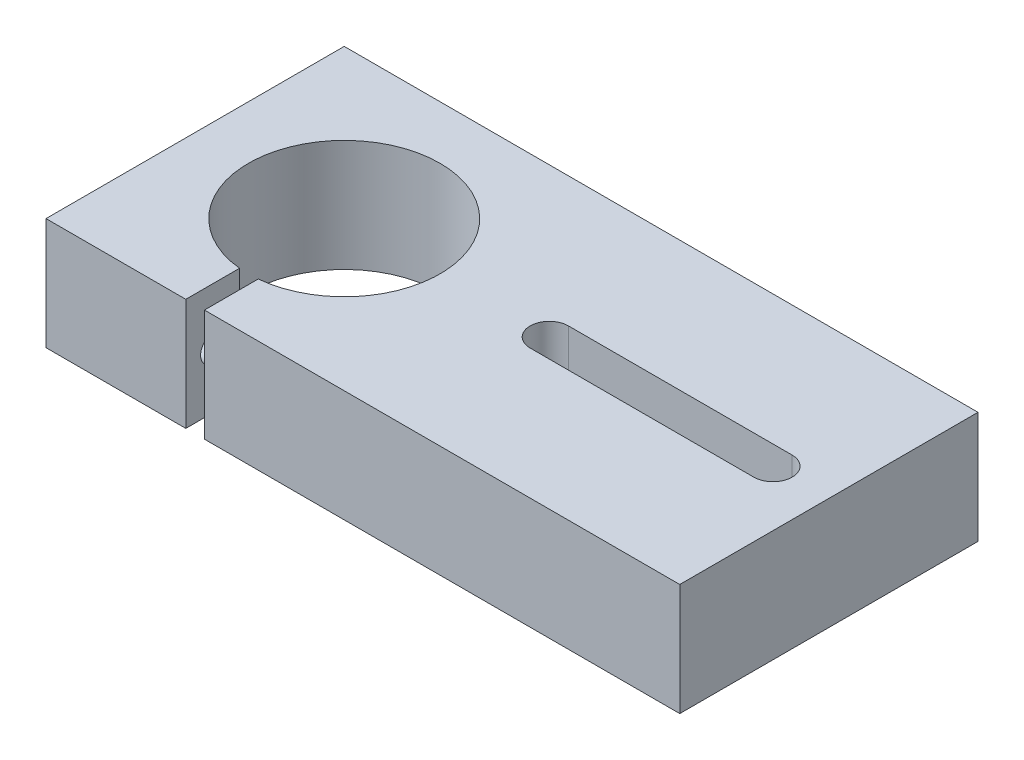
from build123d import *

# Parameters (mm, degrees)
SKETCH1_W                                      = 107.95
SKETCH1_H                                      = 50.8
BOSS_EXTRUDE1_DEPTH                            = 9.525
SKETCH2_R                                      = 16.3195
CUT_EXTRUDE1_DEPTH                             = 19.05
SKETCH3_W                                      = 3.175
SKETCH3_H                                      = 25.4
CUT_EXTRUDE2_DEPTH                             = 19.05
CBORE_FOR_8_SOCKET_HEAD_CAP_SCREW1_D           = 4.4958
CBORE_FOR_8_SOCKET_HEAD_CAP_SCREW1_DEPTH       = 23.8125
CBORE_FOR_8_SOCKET_HEAD_CAP_SCREW1_CBORE_D     = 7.9375
CBORE_FOR_8_SOCKET_HEAD_CAP_SCREW1_CBORE_DEPTH = 4.1656
F_8_32_TAPPED_HOLE1_D                          = 3.4544
F_8_32_TAPPED_HOLE1_DEPTH                      = 25.4
F_8_32_TAPPED_HOLE1_TIP                        = 1.037806461
CUT_EXTRUDE3_DEPTH                             = 19.05


with BuildPart() as part:
    # Sketch1 → Boss-Extrude1 (new, symmetric)
    with BuildSketch(Plane(origin=(0, 0, 0), x_dir=(1, 0, 0), z_dir=(0, 1, 0))):
        Rectangle(SKETCH1_W, SKETCH1_H)
    extrude(amount=BOSS_EXTRUDE1_DEPTH, both=True)

    # Sketch2 → Cut-Extrude1 (cut)
    with BuildSketch(Plane(origin=(0, 9.525, 0), x_dir=(1, 0, 0), z_dir=(0, 1, 0))):
        with Locations(Location((-28.575, 0, 0), (0, 0, 270))):
            Circle(SKETCH2_R)
    extrude(amount=-CUT_EXTRUDE1_DEPTH, mode=Mode.SUBTRACT)

    # Sketch3 → Cut-Extrude2 (cut)
    with BuildSketch(Plane(origin=(0, 9.525, 0), x_dir=(1, 0, 0), z_dir=(0, 1, 0))):
        with Locations((-28.575, -12.7)):
            Rectangle(SKETCH3_W, SKETCH3_H)
    extrude(amount=-CUT_EXTRUDE2_DEPTH, mode=Mode.SUBTRACT)

    # CBORE for #8 Socket Head Cap Screw1
    with Locations(Plane.ZY.offset(53.975)):
        with Locations((20.6375, 0)):
            CounterBoreHole(CBORE_FOR_8_SOCKET_HEAD_CAP_SCREW1_D / 2, CBORE_FOR_8_SOCKET_HEAD_CAP_SCREW1_CBORE_D / 2, CBORE_FOR_8_SOCKET_HEAD_CAP_SCREW1_CBORE_DEPTH, depth=CBORE_FOR_8_SOCKET_HEAD_CAP_SCREW1_DEPTH)

    # #8-32 Tapped Hole1
    with Locations(Plane.ZY.offset(26.9875)):
        with Locations((20.6375, 0)):
            Hole(F_8_32_TAPPED_HOLE1_D / 2, depth=F_8_32_TAPPED_HOLE1_DEPTH)
            with Locations((0, 0, -(F_8_32_TAPPED_HOLE1_DEPTH + F_8_32_TAPPED_HOLE1_TIP / 2))):  # 118° drill point
                Cone(0, F_8_32_TAPPED_HOLE1_D / 2, F_8_32_TAPPED_HOLE1_TIP, mode=Mode.SUBTRACT)

    # Sketch12 → Cut-Extrude3 (cut)
    with BuildSketch(Plane(origin=(0, 9.525, 0), x_dir=(1, 0, 0), z_dir=(0, 1, 0))):
        with BuildLine():
            Line((6.35, 3.2639), (44.45, 3.2639))
            ThreePointArc((44.45, 3.2639), (47.7139, 0), (44.45, -3.2639))
            Line((44.45, -3.2639), (6.35, -3.2639))
            ThreePointArc((6.35, -3.2639), (3.0861, 0), (6.35, 3.2639))
        make_face()
    extrude(amount=-CUT_EXTRUDE3_DEPTH, mode=Mode.SUBTRACT)


solid = part.part
